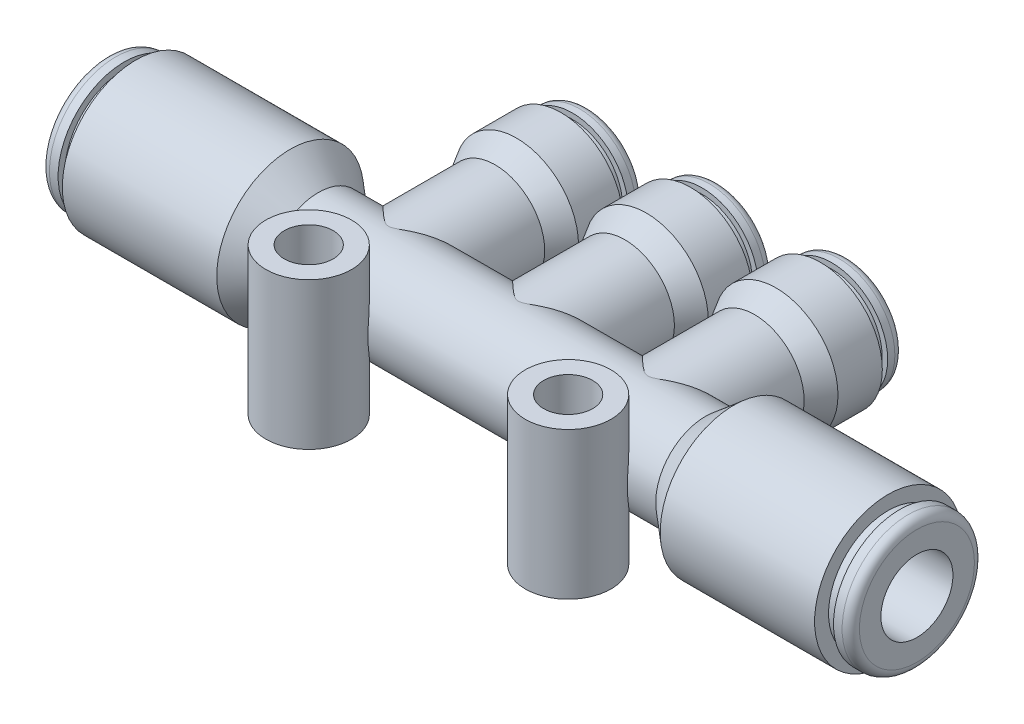
from build123d import *

# Parameters (mm, degrees)
SKETCH9_R               = 1.984375
SKETCH9_R_2             = 1.222375
EXTRUDE1_DEPTH          = 4.3688
LPATTERN1_COUNT         = 2
LPATTERN1_PITCH         = 11.43
LPATTERN1_2_COUNT       = 2
LPATTERN1_2_PITCH       = 11.43
SKETCH16_R              = 1.984375
CUT_EXTRUDE4_DEPTH      = 39.803843609
SKETCH17_R              = 1.222375
CUT_EXTRUDE5_DEPTH      = 41.562734363
SKETCH15_R              = 2.413
CUT_EXTRUDE3_DEPTH      = 58.363407462
SKETCH18_R              = 3.77825
SKETCH18_R_2            = 2.159
EXTRUDE2_DEPTH          = 6.477
EXTRUDE2_2_DEPTH        = 6.477
CUT_EXTRUDE6_DEPTH      = 41.562734363
CUT_EXTRUDE6_DEPTH_BACK = 41.562734363
SKETCH18_2_R            = 2.159


with BuildPart() as part:
    # Sketch8 → Revolve1 (revolve)
    with BuildSketch(Plane(origin=(0, 0, 0), x_dir=(0, 0, -1), z_dir=(1, 0, 0))):
        with BuildLine():
            Line((16.764, 4.9149), (17.399, 4.9149))
            ThreePointArc((17.399, 4.9149), (17.937815367, 4.691715367), (18.161, 4.1529))
            Line((18.161, 4.1529), (18.161, 2.365375))
            Line((18.161, 2.365375), (17.78, 1.984375))
            Line((17.78, 1.984375), (0, 1.984375))
            Line((0, 1.984375), (0, 4.3688))
            Line((0, 4.3688), (9.948333333, 4.3688))
            Line((9.948333333, 4.3688), (11.840079225, 5.461))
            Line((11.840079225, 5.461), (15.748, 5.461))
            Line((15.748, 5.461), (15.748, 4.42341))
            Line((15.748, 4.42341), (16.764, 4.42341))
            Line((16.764, 4.42341), (16.764, 4.9149))
        make_face()
    revolve(axis=Axis((0, 0, 0), (0, 0, -1)))

    # Sketch9 → Extrude1 (add)
    with BuildSketch(Plane.XY):
        Circle(SKETCH9_R)
        Circle(SKETCH9_R_2, mode=Mode.SUBTRACT)
    extrude(amount=-EXTRUDE1_DEPTH)


with BuildPart() as lpattern1_1:
    # LPattern1: pattern copy
    add(part.part.moved(Location(Vector(-1, 0, 0) * (1 * LPATTERN1_PITCH))))


with BuildPart() as lpattern1_2_1:
    # LPattern1 2: pattern copy
    add(part.part.moved(Location(Vector(1, 0, 0) * (1 * LPATTERN1_2_PITCH))))


with BuildPart() as lpattern1_2_2:
    # LPattern1 2: pattern copy
    add(lpattern1_1.part.moved(Location(Vector(1, 0, 0) * (1 * LPATTERN1_2_PITCH))))


with BuildPart() as body_5:
    # Sketch14 → Revolve3 (revolve)
    with BuildSketch(Plane(origin=(0, 0, 0), x_dir=(1, 0, 0), z_dir=(0, 1, 0))):
        with BuildLine():
            Line((35.687, -3.175), (18.3388, -3.175))
            Line((18.3388, -3.175), (18.3388, -2.413))
            Line((18.3388, -2.413), (0, -2.413))
            Line((0, -2.413), (0, -4.40436))
            Line((0, -4.40436), (17.0688, -4.40436))
            Line((17.0688, -4.40436), (19.538876166, -6.477))
            Line((19.538876166, -6.477), (33.147, -6.477))
            Line((33.147, -6.477), (33.147, -5.24637))
            Line((33.147, -5.24637), (34.163, -5.24637))
            Line((34.163, -5.24637), (34.163, -5.8293))
            Line((34.163, -5.8293), (34.925, -5.8293))
            ThreePointArc((34.925, -5.8293), (35.463815367, -5.606115367), (35.687, -5.0673))
            Line((35.687, -5.0673), (35.687, -3.175))
        make_face()
    revolve(axis=Axis((35.687, 0, 0), (-1, 0, 0)))


with BuildPart() as body_6:
    # Mirror3: mirrored copy
    add(body_5.part.mirror(Plane(origin=(0, 0, 0), x_dir=(0, 0, 1), z_dir=(1, 0, 0))))

    # Combine2: union body 5, LPattern1 2_2, LPattern1 2_1, LPattern1_1, part
    add(body_5.part)
    add(lpattern1_2_2.part)
    add(lpattern1_2_1.part)
    add(lpattern1_1.part)
    add(part.part)

    # Sketch16 → Cut-Extrude4 (cut, through all)
    with BuildSketch(Plane(origin=(0, 0, -4.3688), x_dir=(-1, 0, 0), z_dir=(0, 0, 1))):
        with Locations((11.43, 0)):
            Circle(SKETCH16_R)
        Circle(SKETCH16_R)
        with Locations((-11.43, 0)):
            Circle(SKETCH16_R)
    extrude(amount=-CUT_EXTRUDE4_DEPTH, mode=Mode.SUBTRACT)

    # Sketch17 → Cut-Extrude5 (cut, through all)
    with BuildSketch(Plane.XY):
        Circle(SKETCH17_R)
        with Locations((-11.43, 0)):
            Circle(SKETCH17_R)
        with Locations((11.43, 0)):
            Circle(SKETCH17_R)
    extrude(amount=-CUT_EXTRUDE5_DEPTH, mode=Mode.SUBTRACT)

    # Sketch15 → Cut-Extrude3 (cut, through all)
    with BuildSketch(Plane.ZY.offset(18.3388)):
        Circle(SKETCH15_R)
    extrude(amount=-CUT_EXTRUDE3_DEPTH, mode=Mode.SUBTRACT)

    # Sketch18<2> → Cut-Extrude6 (cut, two sides: drawn at the far end of the back side and taken through both)
    with BuildSketch(Plane(origin=(0, 0, 0), x_dir=(1, 0, 0), z_dir=(0, 1, 0)).offset(-CUT_EXTRUDE6_DEPTH_BACK)):
        with Locations((-11.43, -6.477)):
            Circle(SKETCH18_2_R)
        with Locations((11.43, -6.477)):
            Circle(SKETCH18_2_R)
    extrude(amount=CUT_EXTRUDE6_DEPTH + CUT_EXTRUDE6_DEPTH_BACK, mode=Mode.SUBTRACT)


with BuildPart() as body_2:
    # Sketch18 → Extrude2 (new, symmetric)
    with BuildSketch(Plane(origin=(0, 0, 0), x_dir=(1, 0, 0), z_dir=(0, 1, 0))):
        with Locations((-11.43, -6.477)):
            Circle(SKETCH18_R)
        with Locations((-11.43, -6.477)):
            Circle(SKETCH18_R_2, mode=Mode.SUBTRACT)
    extrude(amount=EXTRUDE2_DEPTH, both=True)


with BuildPart() as body_3:
    # Sketch18 → Extrude2 2 (new, symmetric)
    with BuildSketch(Plane(origin=(0, 0, 0), x_dir=(1, 0, 0), z_dir=(0, 1, 0))):
        with Locations((11.43, -6.477)):
            Circle(SKETCH18_R)
        with Locations((11.43, -6.477)):
            Circle(SKETCH18_R_2, mode=Mode.SUBTRACT)
    extrude(amount=EXTRUDE2_2_DEPTH, both=True)


solid = Compound([body_6.part, body_2.part, body_3.part])
